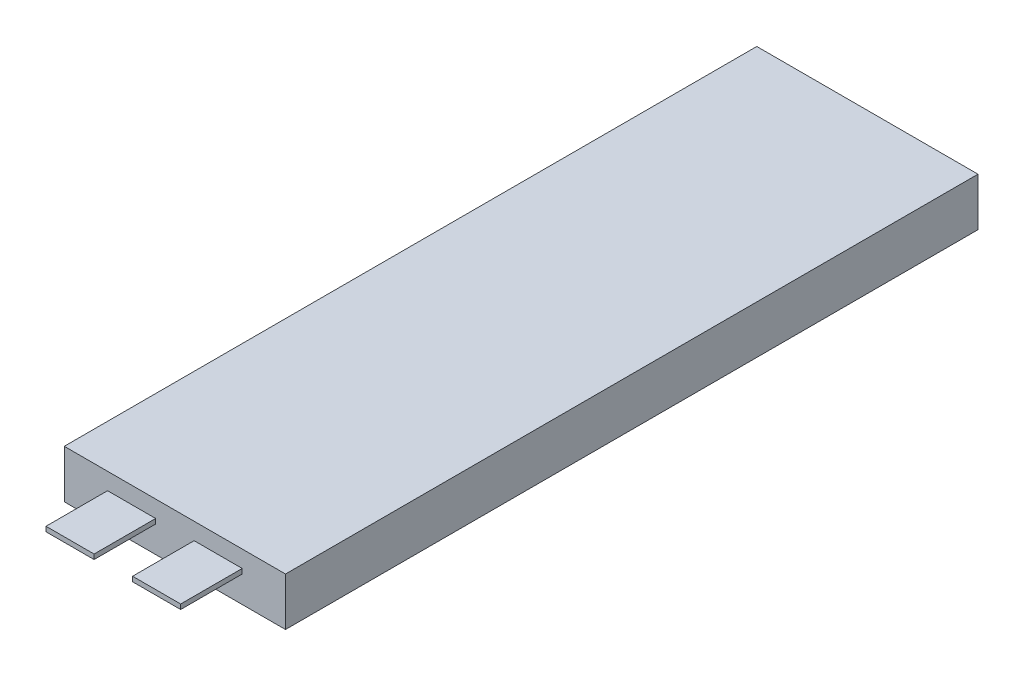
from build123d import *

# Parameters (mm, degrees)
SKETCH1_W           = 46
SKETCH1_H           = 144
CELL_DEPTH          = 10
SKETCH2_W           = 10
SKETCH2_H           = 1
BOSS_EXTRUDE1_DEPTH = 12.8


with BuildPart() as part:
    # Sketch1 → cell (new body)
    with BuildSketch(Plane(origin=(0, 0, 0), x_dir=(1, 0, 0), z_dir=(0, 1, 0))):
        Rectangle(SKETCH1_W, SKETCH1_H)
    extrude(amount=CELL_DEPTH)

    # Sketch2 → Boss-Extrude1 (add)
    with BuildSketch(Plane.XY.offset(72)):
        with Locations((-9, 6)):
            Rectangle(SKETCH2_W, SKETCH2_H)
        with Locations((9, 6)):
            Rectangle(SKETCH2_W, SKETCH2_H)
    extrude(amount=BOSS_EXTRUDE1_DEPTH)


solid = part.part
